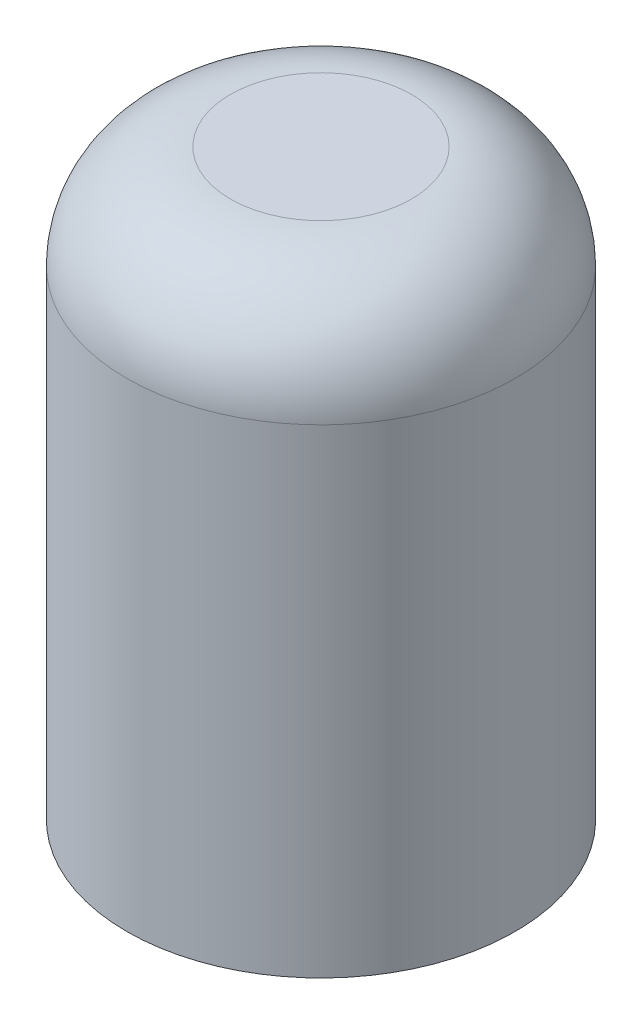
from build123d import *

# Parameters (mm, degrees)
SKETCH1_R           = 4.7625
BOSS_EXTRUDE1_DEPTH = 14.2875
FILLET1_R           = 2.54
SKETCH2_R           = 1.5875
CUT_EXTRUDE1_DEPTH  = 6.35


with BuildPart() as part:
    # Sketch1 → Boss-Extrude1 (new body)
    with BuildSketch(Plane(origin=(0, 0, 0), x_dir=(1, 0, 0), z_dir=(0, 1, 0))):
        with Locations(Location((0, 0, 0), (0, 0, 270))):
            Circle(SKETCH1_R)
    extrude(amount=BOSS_EXTRUDE1_DEPTH)

    # Fillet1
    fillet1_edges = [part.edges().sort_by_distance(p)[0] for p in [
        (0, 14.2875, -4.7625),
    ]]
    fillet(fillet1_edges, radius=FILLET1_R)

    # Sketch2 → Cut-Extrude1 (cut)
    with BuildSketch(Plane.XZ):
        with Locations(Location((0, 0, 0), (0, 0, 270))):
            Circle(SKETCH2_R)
    extrude(amount=-CUT_EXTRUDE1_DEPTH, mode=Mode.SUBTRACT)


solid = part.part
